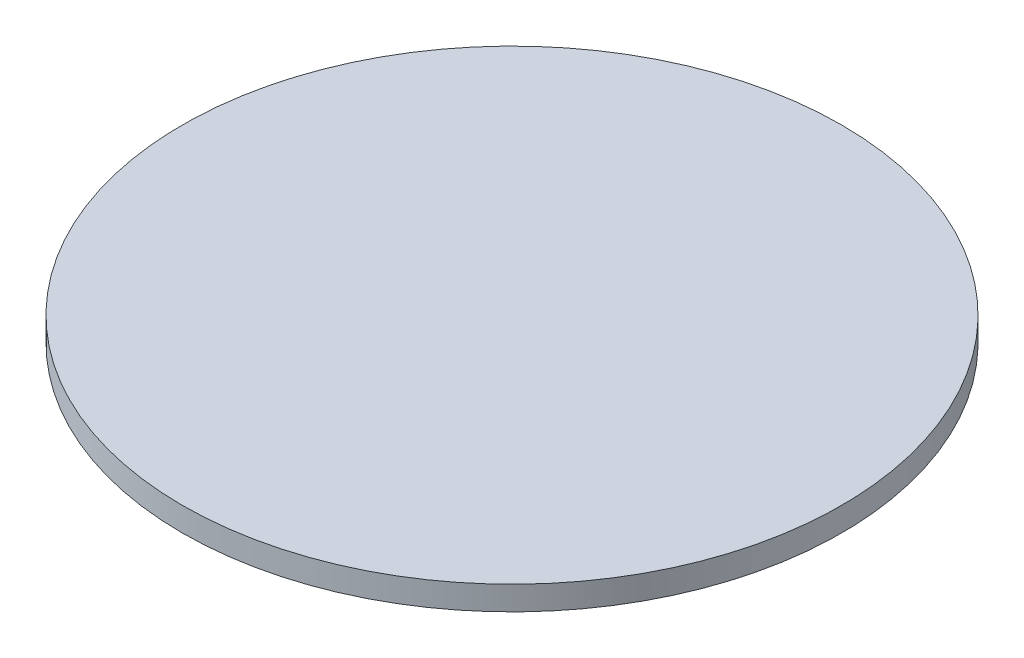
from build123d import *

# Parameters (mm, degrees)
SKETCH1_R           = 165
BOSS_EXTRUDE1_DEPTH = 12
SKETCH2_R           = 145
SKETCH2_R_2         = 140
CUT_EXTRUDE1_DEPTH  = 6


with BuildPart() as part:
    # Sketch1 → Boss-Extrude1 (new body)
    with BuildSketch(Plane(origin=(0, 0, 0), x_dir=(1, 0, 0), z_dir=(0, 1, 0))):
        with Locations(Location((0, 0, 0), (0, 0, 270))):
            Circle(SKETCH1_R)
    extrude(amount=BOSS_EXTRUDE1_DEPTH)

    # Sketch2 → Cut-Extrude1 (cut)
    with BuildSketch(Plane.XZ):
        with Locations(Location((0, 0, 0), (0, 0, 270))):
            Circle(SKETCH2_R)
        with Locations(Location((0, 0, 0), (0, 0, 270))):
            Circle(SKETCH2_R_2, mode=Mode.SUBTRACT)
    extrude(amount=-CUT_EXTRUDE1_DEPTH, mode=Mode.SUBTRACT)


solid = part.part
